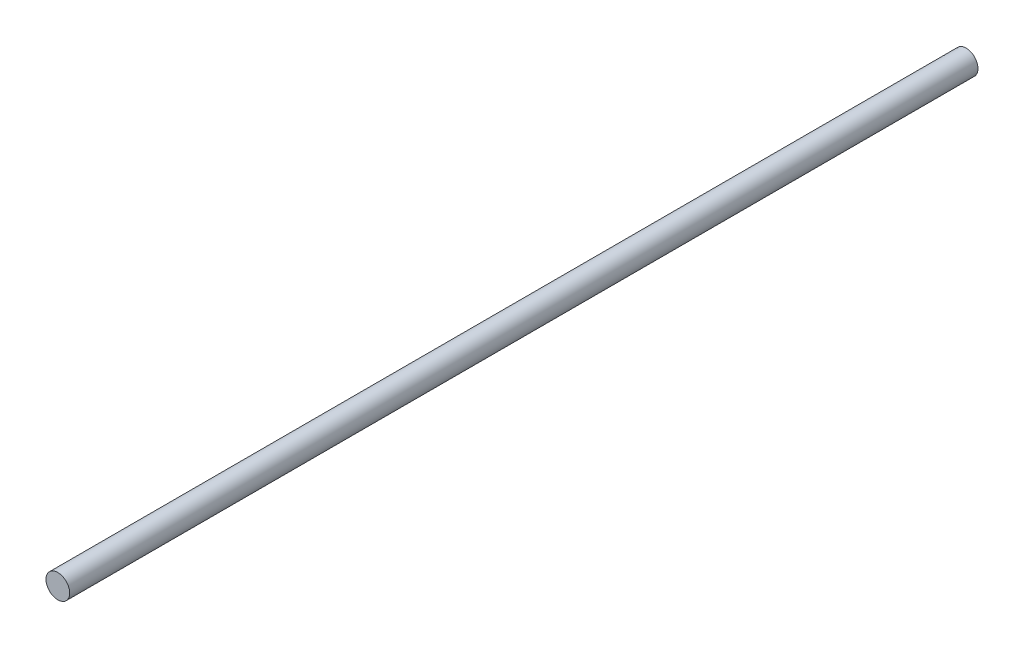
from build123d import *

# Parameters (mm, degrees)
SKETCH_1_R      = 6
EXTRUDE_1_DEPTH = 460


with BuildPart() as part:
    # Эскиз1 → Бобышка-Вытянуть1 (new body)
    with BuildSketch(Plane.XY):
        Circle(SKETCH_1_R)
    extrude(amount=EXTRUDE_1_DEPTH)


solid = part.part
